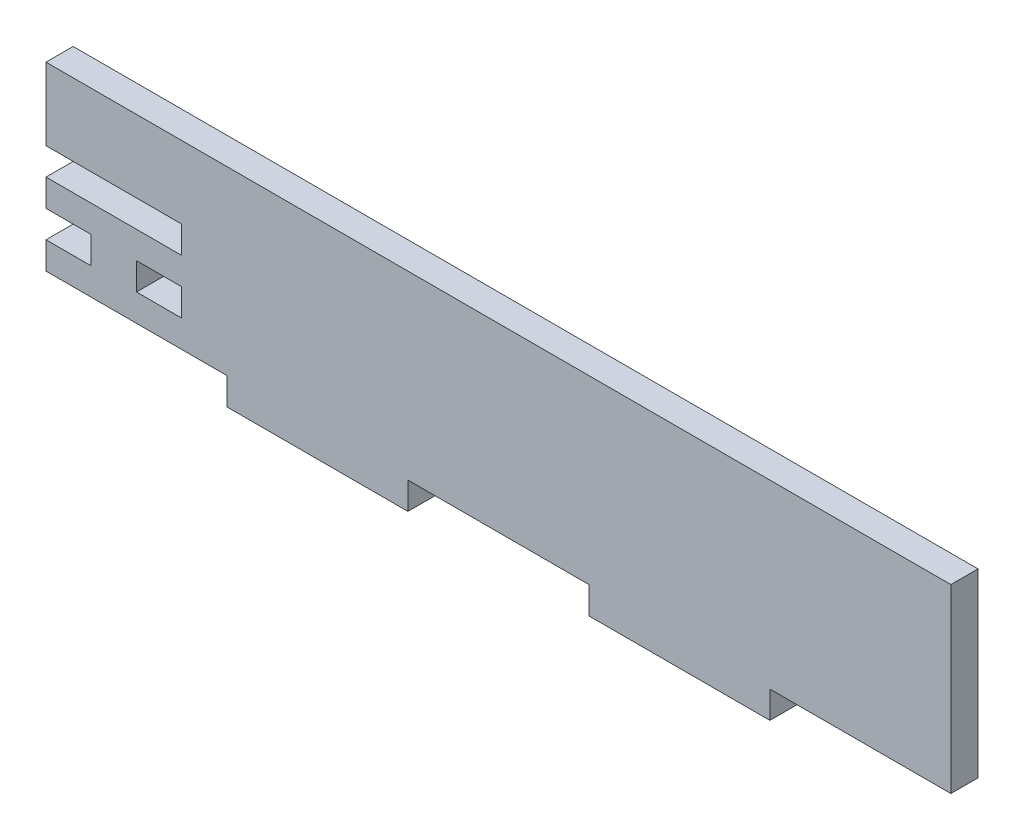
from build123d import *

# Parameters (mm, degrees)
SKETCH1_W           = 200
SKETCH1_H           = 46
BOSS_EXTRUDE1_DEPTH = 6
SKETCH2_W           = 40
SKETCH2_H           = 6
CUT_EXTRUDE1_DEPTH  = 6
SKETCH3_W           = 10
SKETCH3_H           = 6
CUT_EXTRUDE2_DEPTH  = 10
SKETCH4_W           = 30
SKETCH4_H           = 6
CUT_EXTRUDE3_DEPTH  = 10


with BuildPart() as part:
    # Sketch1 → Boss-Extrude1 (new body)
    with BuildSketch(Plane.XY):
        Rectangle(SKETCH1_W, SKETCH1_H)
    extrude(amount=BOSS_EXTRUDE1_DEPTH)

    # Sketch2 → Cut-Extrude1 (cut)
    with BuildSketch(Plane.XY.offset(6)):
        with Locations((0, -20)):
            Rectangle(SKETCH2_W, SKETCH2_H)
        with Locations((-80, -20)):
            Rectangle(SKETCH2_W, SKETCH2_H)
        with Locations((80, -20)):
            Rectangle(SKETCH2_W, SKETCH2_H)
    extrude(amount=-CUT_EXTRUDE1_DEPTH, mode=Mode.SUBTRACT)

    # Sketch3 → Cut-Extrude2 (cut)
    with BuildSketch(Plane.XY.offset(6)):
        with Locations((-95, -8)):
            Rectangle(SKETCH3_W, SKETCH3_H)
        with Locations((-75, -8)):
            Rectangle(SKETCH3_W, SKETCH3_H)
    extrude(amount=-CUT_EXTRUDE2_DEPTH, mode=Mode.SUBTRACT)

    # Sketch4 → Cut-Extrude3 (cut)
    with BuildSketch(Plane.XY.offset(6)):
        with Locations((-85, 4)):
            Rectangle(SKETCH4_W, SKETCH4_H)
    extrude(amount=-CUT_EXTRUDE3_DEPTH, mode=Mode.SUBTRACT)


solid = part.part
